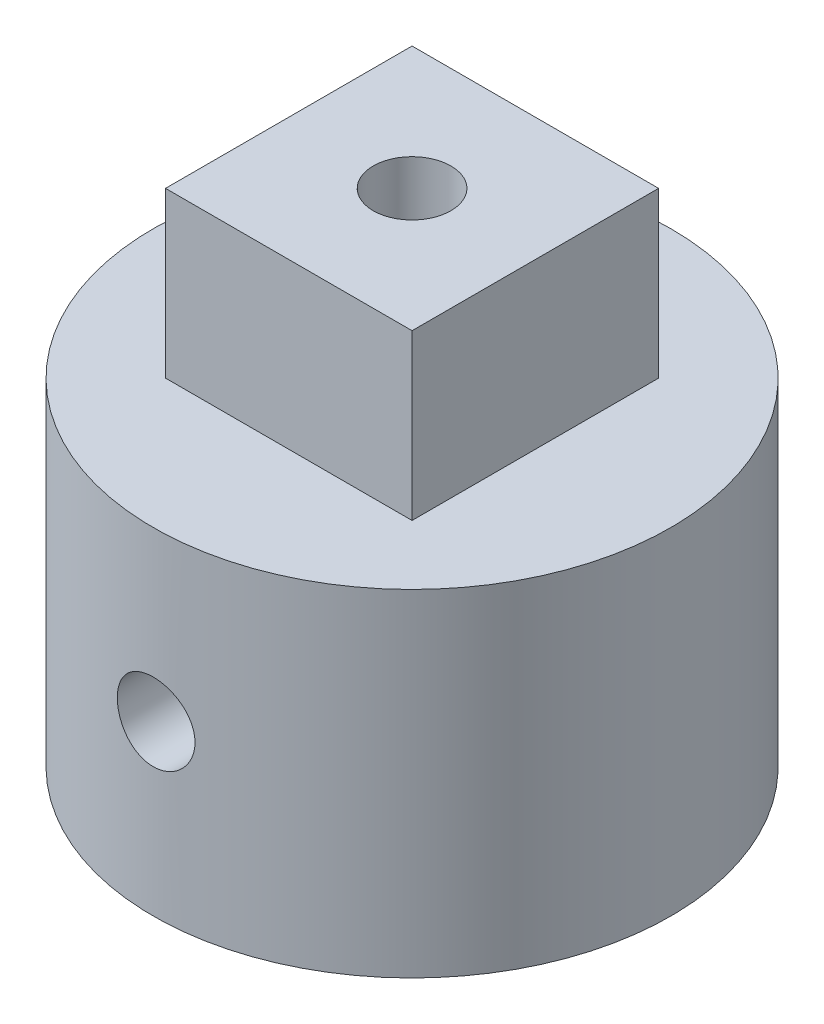
from build123d import *

# Parameters (mm, degrees)
SKETCH1_W           = 9.525
SKETCH1_H           = 9.525
SKETCH1_R           = 1.5
BOSS_EXTRUDE1_DEPTH = 6.35
SKETCH2_R           = 10
BOSS_EXTRUDE2_DEPTH = 13
SKETCH3_R           = 1.55
CUT_EXTRUDE1_DEPTH  = 11
SKETCH5_R           = 1.5
CUT_EXTRUDE2_DEPTH  = 10


with BuildPart() as part:
    # Sketch1 → Boss-Extrude1 (new body)
    with BuildSketch(Plane(origin=(0, 0, 0), x_dir=(1, 0, 0), z_dir=(0, 1, 0))):
        Rectangle(SKETCH1_W, SKETCH1_H)
        with Locations(Location((0, 0, 0), (0, 0, 270))):
            Circle(SKETCH1_R, mode=Mode.SUBTRACT)
    extrude(amount=BOSS_EXTRUDE1_DEPTH)

    # Sketch2 → Boss-Extrude2 (add)
    with BuildSketch(Plane.XZ):
        with Locations(Location((0, 0, 0), (0, 0, 90))):
            Circle(SKETCH2_R)
    extrude(amount=BOSS_EXTRUDE2_DEPTH)

    # Sketch3 → Cut-Extrude1 (cut)
    with BuildSketch(Plane.XZ.offset(13)):
        with Locations(Location((0, 0, 0), (0, 0, 270))):
            Circle(SKETCH3_R)
    extrude(amount=-CUT_EXTRUDE1_DEPTH, mode=Mode.SUBTRACT)

    # Sketch5 → Cut-Extrude2 (cut, symmetric)
    with BuildSketch(Plane.XY):
        with Locations((0, -6.5)):
            Circle(SKETCH5_R)
    extrude(amount=CUT_EXTRUDE2_DEPTH, both=True, mode=Mode.SUBTRACT)


solid = part.part
